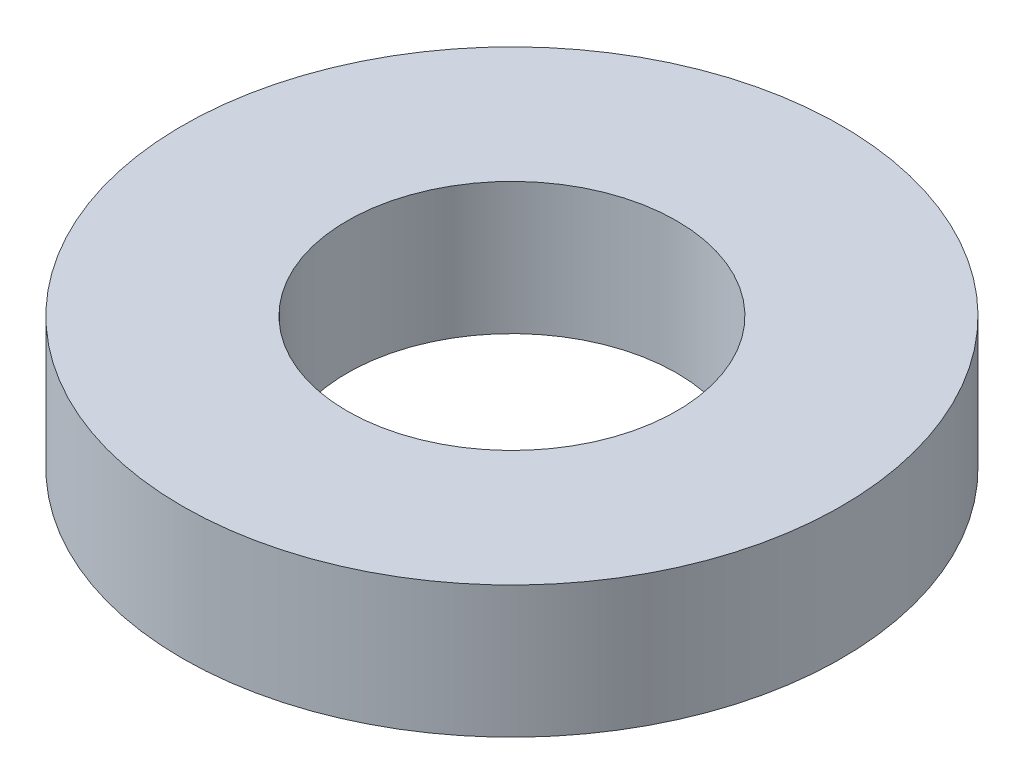
from build123d import *

# Parameters (mm, degrees)
SKETCH_1_R      = 5
SKETCH_1_R_2    = 2.5
EXTRUDE_1_DEPTH = 2


with BuildPart() as part:
    # 草图1 → 凸台-拉伸1 (new body)
    with BuildSketch(Plane(origin=(0, 0, 0), x_dir=(1, 0, 0), z_dir=(0, 1, 0))):
        with Locations(Location((0, 0, 0), (0, 0, 270))):
            Circle(SKETCH_1_R)
        with Locations(Location((0, 0, 0), (0, 0, 270))):
            Circle(SKETCH_1_R_2, mode=Mode.SUBTRACT)
    extrude(amount=EXTRUDE_1_DEPTH)


solid = part.part
